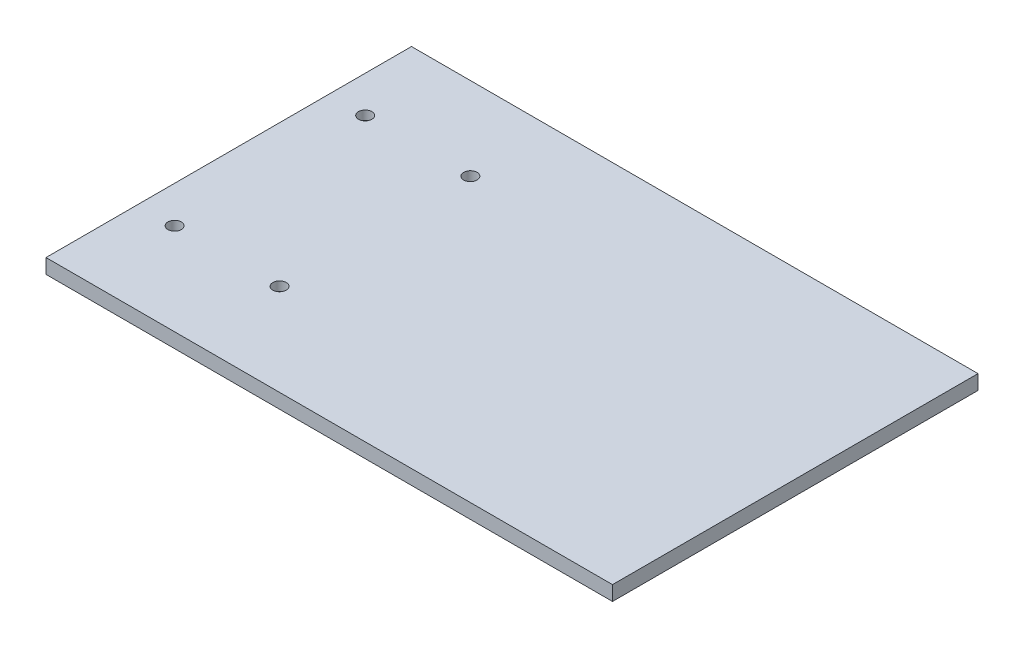
from build123d import *

# Parameters (mm, degrees)
SKETCH1_W                                            = 465
SKETCH1_H                                            = 300
BOSS_EXTRUDE1_DEPTH                                  = 12
CSK_FOR_M10_COUNTERSUNK_FLAT_HEAD_SCREW1_D           = 11
CSK_FOR_M10_COUNTERSUNK_FLAT_HEAD_SCREW1_DEPTH       = 20.003
CSK_FOR_M10_COUNTERSUNK_FLAT_HEAD_SCREW1_CSINK_D     = 20
CSK_FOR_M10_COUNTERSUNK_FLAT_HEAD_SCREW1_CSINK_ANGLE = 90
CSK_FOR_M10_COUNTERSUNK_FLAT_HEAD_SCREW1_TIP         = 3.304733405


with BuildPart() as part:
    # Sketch1 → Boss-Extrude1 (new body)
    with BuildSketch(Plane(origin=(0, 0, 0), x_dir=(1, 0, 0), z_dir=(0, 1, 0))):
        Rectangle(SKETCH1_W, SKETCH1_H)
    extrude(amount=BOSS_EXTRUDE1_DEPTH)

    # CSK for M10 Countersunk Flat Head Screw1
    with Locations(Plane(origin=(0, 0, 0), x_dir=(-1, 0, 0), z_dir=(0, -1, 0))):
        with Locations((116.169058485, -74.612719009), (202.304435362, -74.612719009), (202.5, 82), (116.169058485, 82)):
            CounterSinkHole(CSK_FOR_M10_COUNTERSUNK_FLAT_HEAD_SCREW1_D / 2, CSK_FOR_M10_COUNTERSUNK_FLAT_HEAD_SCREW1_CSINK_D / 2, depth=CSK_FOR_M10_COUNTERSUNK_FLAT_HEAD_SCREW1_DEPTH, counter_sink_angle=CSK_FOR_M10_COUNTERSUNK_FLAT_HEAD_SCREW1_CSINK_ANGLE)
            with Locations((0, 0, -(CSK_FOR_M10_COUNTERSUNK_FLAT_HEAD_SCREW1_DEPTH + CSK_FOR_M10_COUNTERSUNK_FLAT_HEAD_SCREW1_TIP / 2))):  # 118° drill point
                Cone(0, CSK_FOR_M10_COUNTERSUNK_FLAT_HEAD_SCREW1_D / 2, CSK_FOR_M10_COUNTERSUNK_FLAT_HEAD_SCREW1_TIP, mode=Mode.SUBTRACT)


solid = part.part
